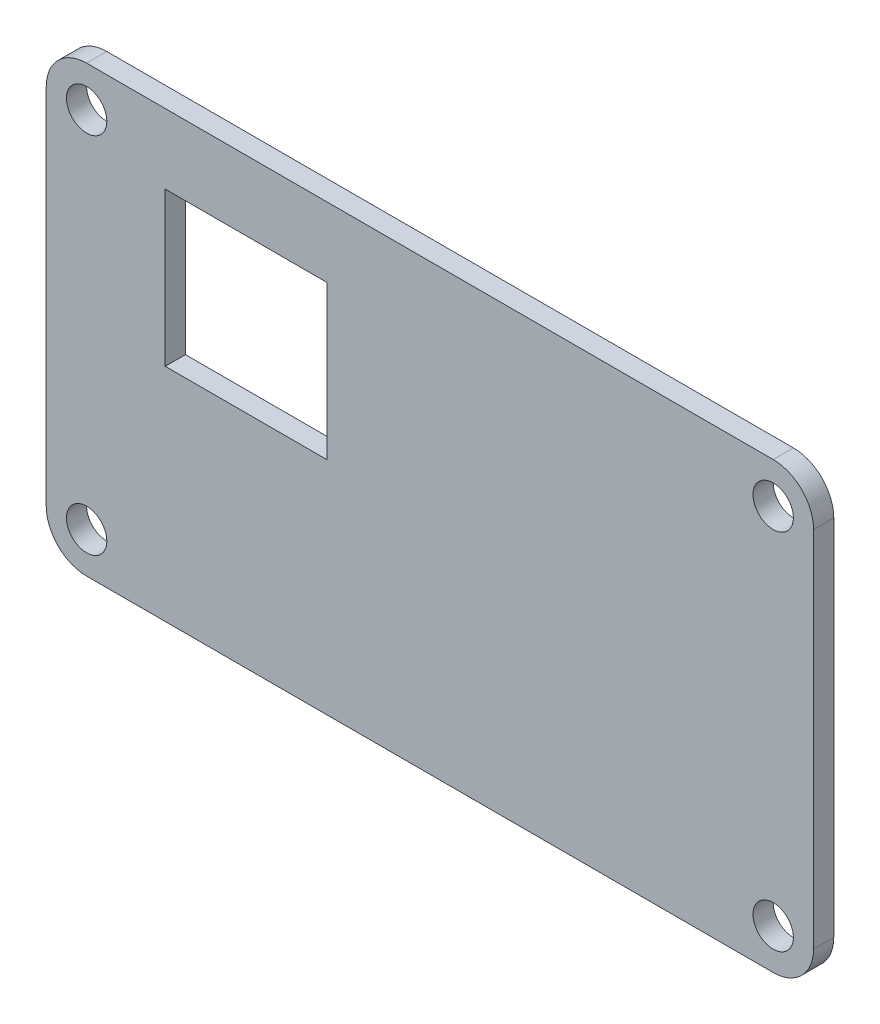
from build123d import *

# Parameters (mm, degrees)
BOSS_EXTRUDE1_DEPTH = 5
SKETCH2_R           = 5
CUT_EXTRUDE1_DEPTH  = 35
SKETCH3_W           = 40
SKETCH3_H           = 38
CUT_EXTRUDE2_DEPTH  = 35


with BuildPart() as part:
    # Sketch1 → Boss-Extrude1 (new body)
    with BuildSketch(Plane.XY):
        with BuildLine():
            Line((10, 0), (180, 0))
            ThreePointArc((180, 0), (187.071067812, 2.928932188), (190, 10))
            Line((190, 10), (190, 100))
            ThreePointArc((190, 100), (187.071067812, 107.071067812), (180, 110))
            Line((180, 110), (10, 110))
            ThreePointArc((10, 110), (2.928932188, 107.071067812), (0, 100))
            Line((0, 100), (0, 10))
            ThreePointArc((0, 10), (2.928932188, 2.928932188), (10, 0))
        make_face()
    extrude(amount=BOSS_EXTRUDE1_DEPTH)

    # Sketch2 → Cut-Extrude1 (cut)
    with BuildSketch(Plane(origin=(0, 0, 0), x_dir=(-1, 0, 0), z_dir=(0, 0, -1))):
        with Locations((-180, 100)):
            Circle(SKETCH2_R)
        with Locations((-10, 100)):
            Circle(SKETCH2_R)
        with Locations((-180, 10)):
            Circle(SKETCH2_R)
        with Locations((-10, 10)):
            Circle(SKETCH2_R)
    extrude(amount=-CUT_EXTRUDE1_DEPTH, mode=Mode.SUBTRACT)

    # Sketch3 → Cut-Extrude2 (cut)
    with BuildSketch(Plane.XY.offset(5)):
        with Locations((49.464961526, 73.72693734)):
            Rectangle(SKETCH3_W, SKETCH3_H)
    extrude(amount=-CUT_EXTRUDE2_DEPTH, mode=Mode.SUBTRACT)


solid = part.part
